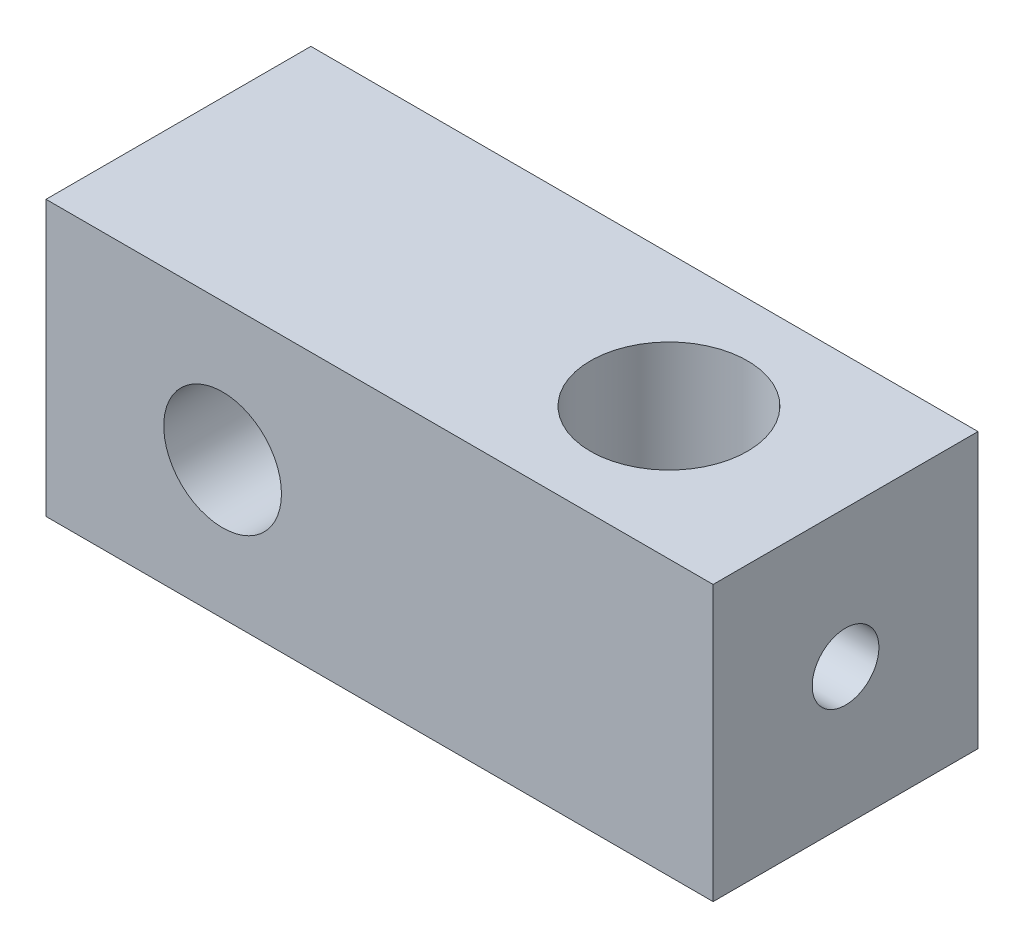
from build123d import *

# Parameters (mm, degrees)
SKETCH1_W             = 68
SKETCH1_H             = 27
BOSS_EXTRUDE1_DEPTH   = 28
SKETCH2_R             = 6
CUT_EXTRUDE1_DEPTH    = 28
SKETCH3_R             = 8
CUT_EXTRUDE2_DEPTH    = 28
M8_TAPPED_HOLE1_D     = 6.8
M8_TAPPED_HOLE1_DEPTH = 15


with BuildPart() as part:
    # Sketch1 → Boss-Extrude1 (new body)
    with BuildSketch(Plane(origin=(0, 0, 0), x_dir=(1, 0, 0), z_dir=(0, 1, 0))):
        with Locations((34, 13.5)):
            Rectangle(SKETCH1_W, SKETCH1_H)
    extrude(amount=BOSS_EXTRUDE1_DEPTH)

    # Sketch2 → Cut-Extrude1 (cut)
    with BuildSketch(Plane.XY):
        with Locations((18, 14)):
            Circle(SKETCH2_R)
    extrude(amount=-CUT_EXTRUDE1_DEPTH, mode=Mode.SUBTRACT)

    # Sketch3 → Cut-Extrude2 (cut)
    with BuildSketch(Plane(origin=(0, 28, 0), x_dir=(1, 0, 0), z_dir=(0, 1, 0))):
        with Locations(Location((50, 13.5, 0), (0, 0, 270))):
            Circle(SKETCH3_R)
    extrude(amount=-CUT_EXTRUDE2_DEPTH, mode=Mode.SUBTRACT)

    # M8 Tapped Hole1
    with Locations(Plane(origin=(68, 0, 0), x_dir=(0, 0, -1), z_dir=(1, 0, 0))):
        with Locations((13.5, 14)):
            Hole(M8_TAPPED_HOLE1_D / 2, depth=M8_TAPPED_HOLE1_DEPTH)


solid = part.part
